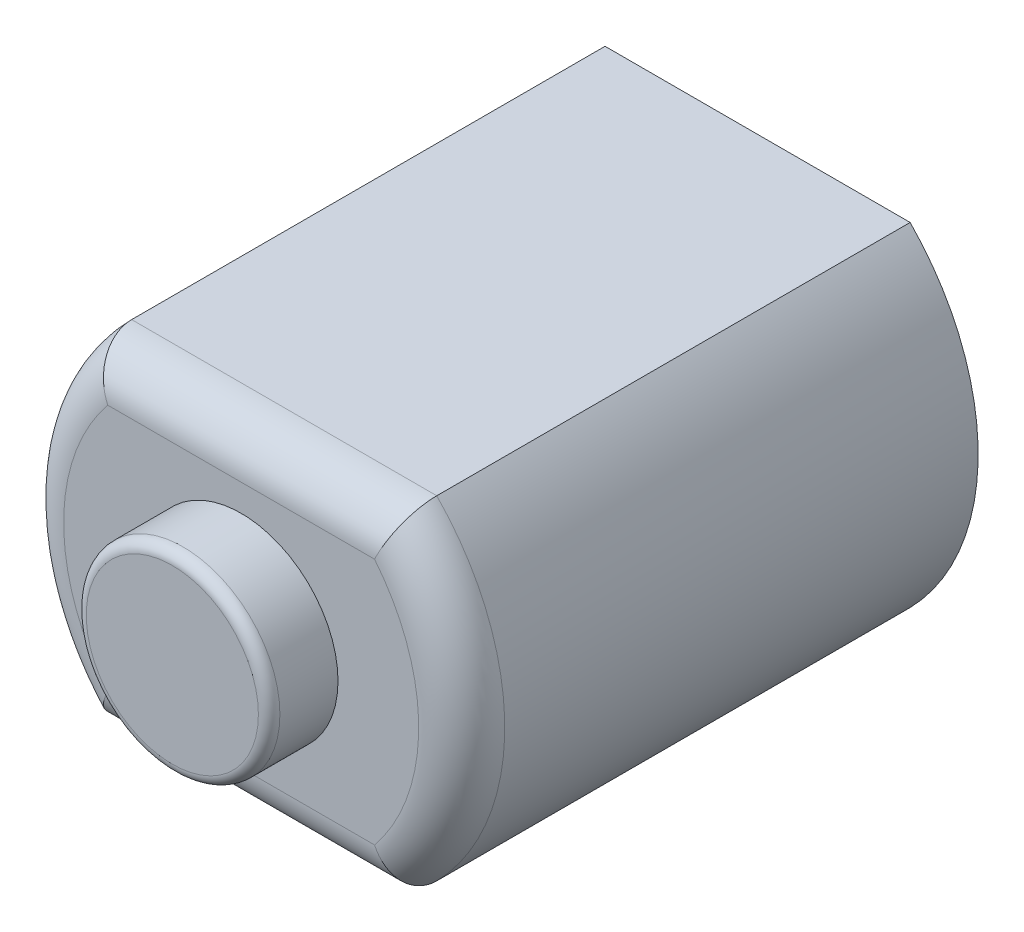
from build123d import *

# Parameters (mm, degrees)
SALIENTE_EXTRUIR1_DEPTH = 24
REDONDEO1_R             = 2
CROQUIS2_R              = 4.5
SALIENTE_EXTRUIR2_DEPTH = 3.2
REDONDEO2_R             = 0.5


with BuildPart() as part:
    # Croquis1 → Saliente-Extruir1 (new body)
    with BuildSketch(Plane.XY):
        with BuildLine():
            Line((7.09, 7.75), (-7.09, 7.75))
            ThreePointArc((-7.09, 7.75), (-10.25, 0), (-7.09, -7.75))
            Line((-7.09, -7.75), (7.09, -7.75))
            ThreePointArc((7.09, -7.75), (10.25, 0), (7.09, 7.75))
        make_face()
    extrude(amount=SALIENTE_EXTRUIR1_DEPTH)

    # Redondeo1
    redondeo1_edges = [part.edges().sort_by_distance(p)[0] for p in [
        (10.25, 0, 24),
        (0, 7.75, 24),
        (-10.25, 0, 24),
        (0, -7.75, 24),
    ]]
    fillet(redondeo1_edges, radius=REDONDEO1_R)

    # Croquis2 → Saliente-Extruir2 (add)
    with BuildSketch(Plane.XY.offset(24)):
        Circle(CROQUIS2_R)
    extrude(amount=SALIENTE_EXTRUIR2_DEPTH)

    # Redondeo2
    redondeo2_edges = [part.edges().sort_by_distance(p)[0] for p in [
        (-4.5, 0, 27.2),
    ]]
    fillet(redondeo2_edges, radius=REDONDEO2_R)


solid = part.part
